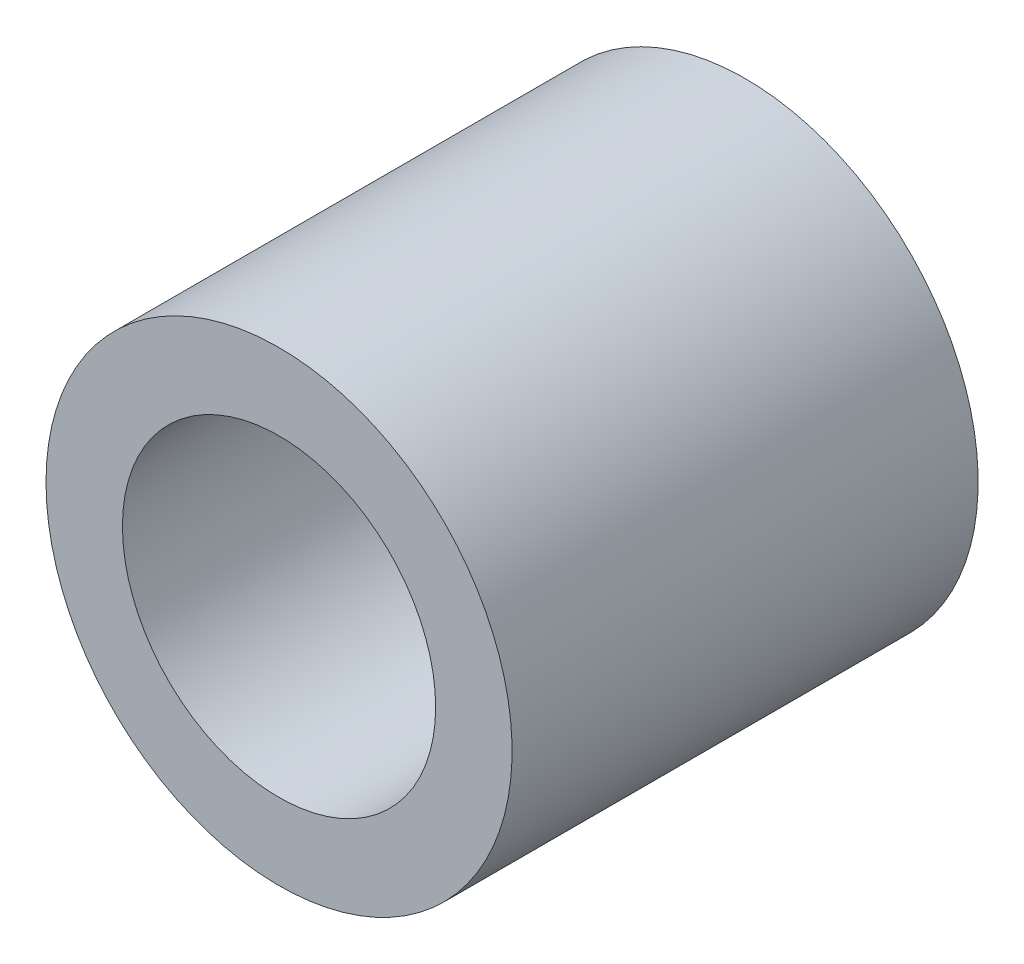
from build123d import *

# Parameters (mm, degrees)
SKETCH1_R      = 4.7625
SKETCH1_R_2    = 3.2004
EXTRUDE1_DEPTH = 4.7625


with BuildPart() as part:
    # Sketch1 → Extrude1 (new, symmetric)
    with BuildSketch(Plane.XY):
        with Locations(Location((0, 0, 0), (0, 0, 180))):
            Circle(SKETCH1_R)
        with Locations(Location((0, 0, 0), (0, 0, 180))):
            Circle(SKETCH1_R_2, mode=Mode.SUBTRACT)
    extrude(amount=EXTRUDE1_DEPTH, both=True)


solid = part.part
